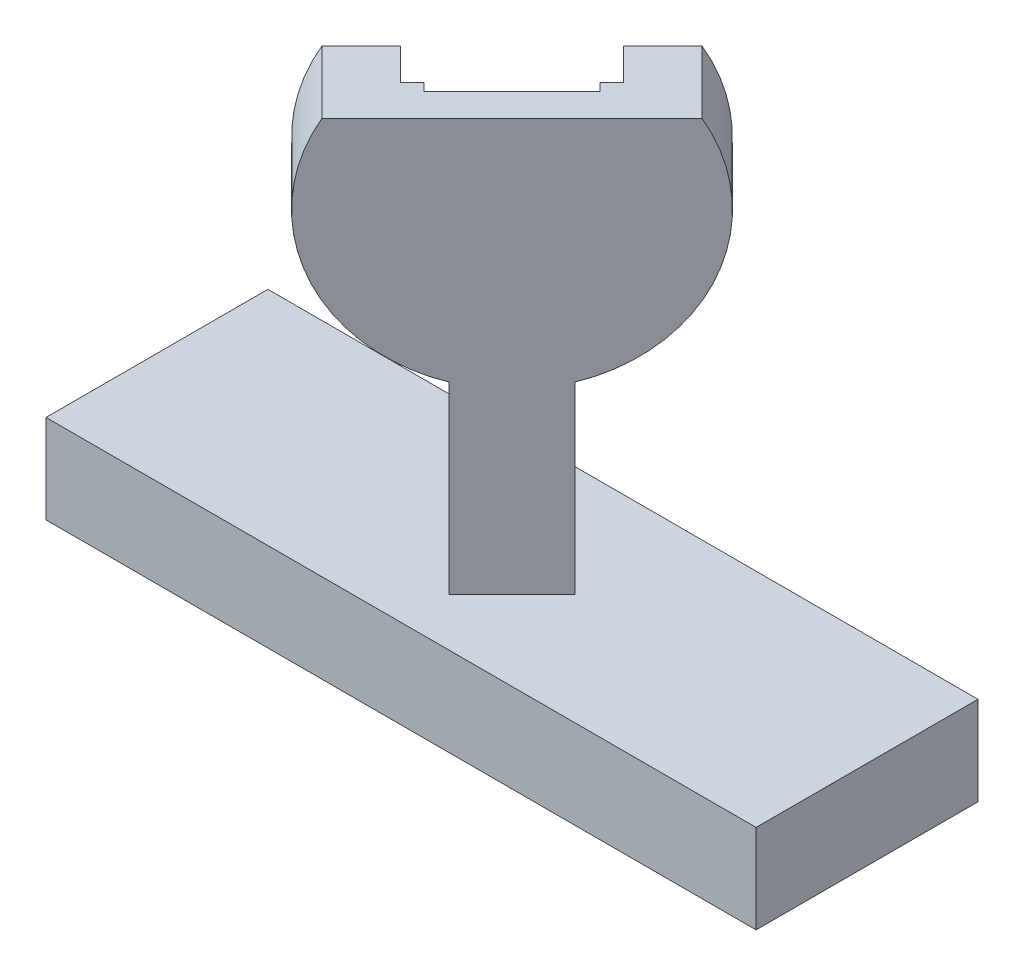
from build123d import *

# Parameters (mm, degrees)
SKETCH1_W                 = 81.28
SKETCH1_H                 = 25.4
BOSS_EXTRUDE1_DEPTH       = 10.16
BOSS_EXTRUDE2_DEPTH       = 25.4
BOSS_EXTRUDE3_DEPTH       = 10.16
BOSS_EXTRUDE4_DEPTH       = 3.81
BOSS_EXTRUDE5_DEPTH       = 5.08
F_8_32_TAPPED_HOLE2_D     = 3.4544
F_8_32_TAPPED_HOLE2_DEPTH = 7.62
F_8_32_TAPPED_HOLE2_TIP   = 1.037806461


with BuildPart() as part:
    # Sketch1 → Boss-Extrude1 (new body)
    # profile 1 of 2: a face of its own
    with BuildSketch(Plane(origin=(0, 0, 0), x_dir=(1, 0, 0), z_dir=(0, 1, 0))):
        Rectangle(SKETCH1_W, SKETCH1_H)
        Polygon((7.184204897, 0), (0, 7.184204897), (-7.184204897, 0), (0, -7.184204897), align=None, mode=Mode.SUBTRACT)
    # profile 2 of 2: a face of its own
    with BuildSketch(Plane(origin=(0, 0, 0), x_dir=(1, 0, 0), z_dir=(0, 1, 0))):
        Polygon((0, -7.184204897), (7.184204897, 0), (0, 7.184204897), (-7.184204897, 0), align=None)
    extrude(amount=-BOSS_EXTRUDE1_DEPTH)

    # Sketch1<3> → Boss-Extrude2 (add)
    with BuildSketch(Plane(origin=(0, 0, 0), x_dir=(1, 0, 0), z_dir=(0, 1, 0))):
        Polygon((0, -7.184204897), (7.184204897, 0), (0, 7.184204897), (-7.184204897, 0), align=None)
    extrude(amount=BOSS_EXTRUDE2_DEPTH)

    # Sketch3 → Boss-Extrude3 (add)
    with BuildSketch(Plane(origin=(3.592102448, 0, 3.592102448), x_dir=(0.7071067811865472, 0, -0.7071067811865479), z_dir=(0.7071067811865479, 0, 0.7071067811865472))):
        with BuildLine():
            ThreePointArc((0, 25.4), (-11.791936413, 33.279120011), (-9.025157402, 47.188657402))
            Line((-9.025157402, 47.188657402), (-15.392758886, 47.188657402))
            ThreePointArc((-15.392758886, 47.188657402), (0, 20.32), (15.392758886, 47.188657402))
            Line((15.392758886, 47.188657402), (9.025157402, 47.188657402))
            ThreePointArc((9.025157402, 47.188657402), (11.791936413, 33.279120011), (0, 25.4))
        make_face()
    extrude(amount=-BOSS_EXTRUDE3_DEPTH)

    # Sketch3<3> → Boss-Extrude4 (add)
    with BuildSketch(Plane(origin=(3.592102448, 0, 3.592102448), x_dir=(0.7071067811865472, 0, -0.7071067811865479), z_dir=(0.7071067811865479, 0, 0.7071067811865472))):
        with BuildLine():
            Line((15.392758886, 47.188657402), (-15.392758886, 47.188657402))
            ThreePointArc((-15.392758886, 47.188657402), (0, 20.32), (15.392758886, 47.188657402))
        make_face()
    extrude(amount=-BOSS_EXTRUDE4_DEPTH)

    # Sketch3<4> → Boss-Extrude5 (add)
    with BuildSketch(Plane(origin=(3.592102448, 0, 3.592102448), x_dir=(0.7071067811865472, 0, -0.7071067811865479), z_dir=(0.7071067811865479, 0, 0.7071067811865472))):
        with BuildLine():
            Line((-7.116675918, 47.188657402), (-9.025157402, 47.188657402))
            ThreePointArc((-9.025157402, 47.188657402), (-11.791936413, 33.279120011), (0, 25.4))
            ThreePointArc((0, 25.4), (11.791936413, 33.279120011), (9.025157402, 47.188657402))
            Line((9.025157402, 47.188657402), (7.116675918, 47.188657402))
            ThreePointArc((7.116675918, 47.188657402), (0, 26.67), (-7.116675918, 47.188657402))
        make_face()
    extrude(amount=-BOSS_EXTRUDE5_DEPTH)

    # #8-32 Tapped Hole2
    with Locations(Plane(origin=(-3.592102448, 0, -3.592102448), x_dir=(-0.7071067811865472, 0, 0.7071067811865479), z_dir=(-0.7071067811865479, 0, -0.7071067811865472))):
        with Locations((15.3035, 38.1635), (-15.3035, 38.1635)):
            Hole(F_8_32_TAPPED_HOLE2_D / 2, depth=F_8_32_TAPPED_HOLE2_DEPTH)
            with Locations((0, 0, -(F_8_32_TAPPED_HOLE2_DEPTH + F_8_32_TAPPED_HOLE2_TIP / 2))):  # 118° drill point
                Cone(0, F_8_32_TAPPED_HOLE2_D / 2, F_8_32_TAPPED_HOLE2_TIP, mode=Mode.SUBTRACT)


solid = part.part
